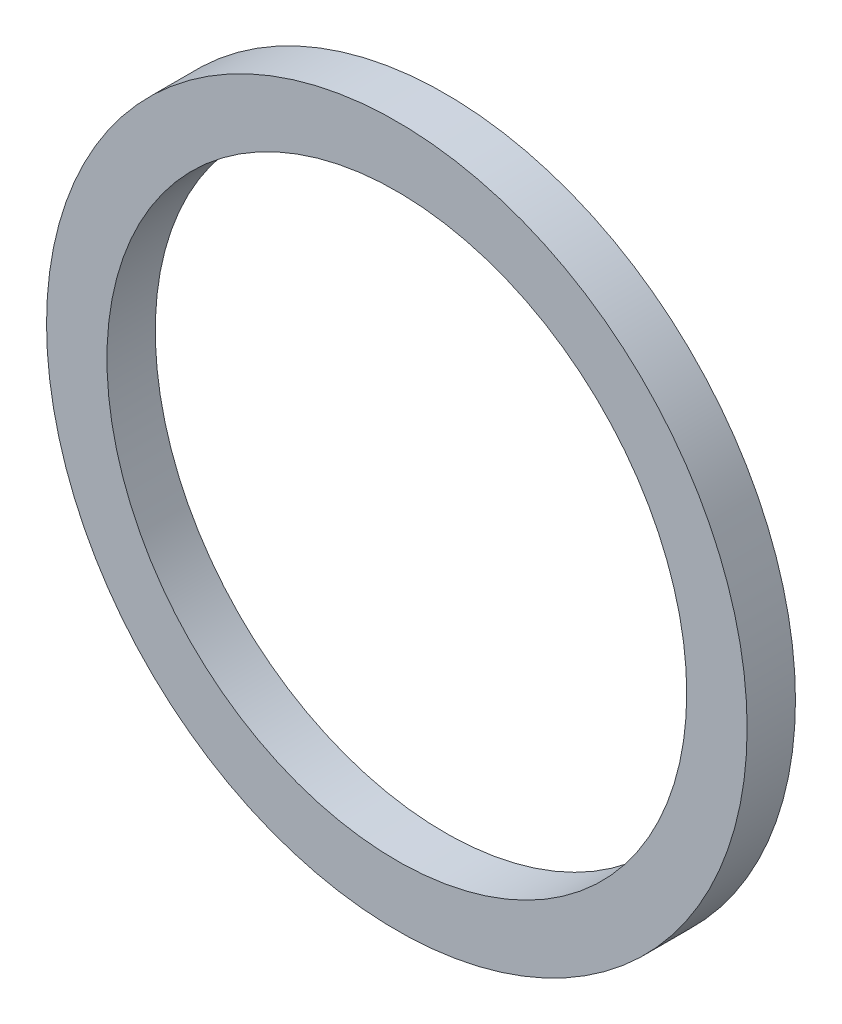
from build123d import *

# Parameters (mm, degrees)
SKETCH1_R           = 72.5
SKETCH1_R_2         = 60
BOSS_EXTRUDE1_DEPTH = 10


with BuildPart() as part:
    # Sketch1 → Boss-Extrude1 (new body)
    with BuildSketch(Plane.XY):
        Circle(SKETCH1_R)
        Circle(SKETCH1_R_2, mode=Mode.SUBTRACT)
    extrude(amount=BOSS_EXTRUDE1_DEPTH)


solid = part.part
